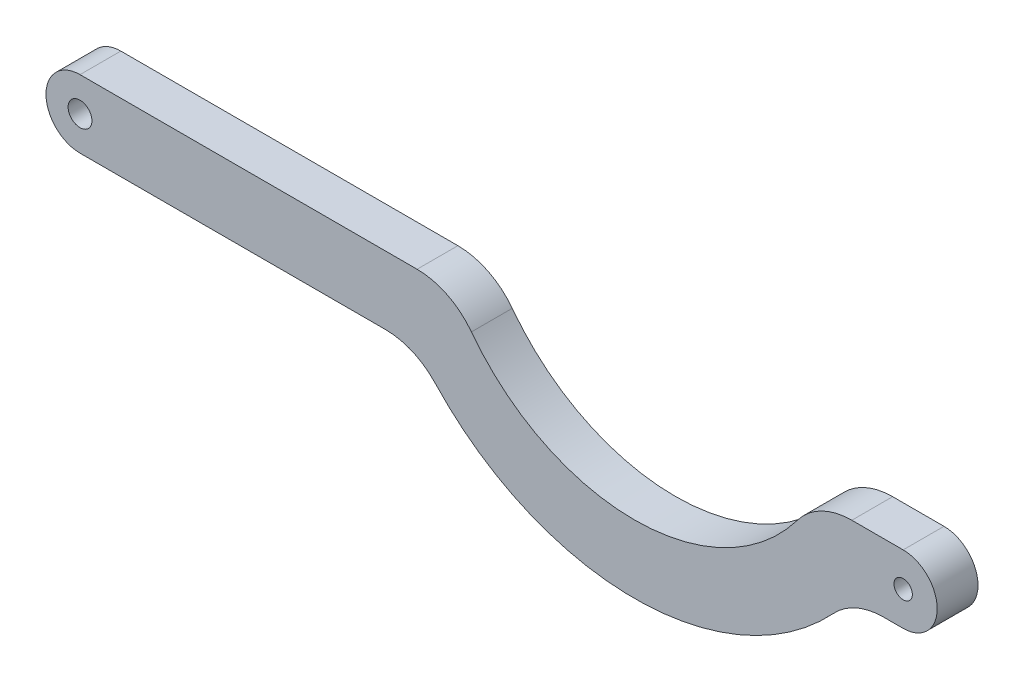
from build123d import *

# Parameters (mm, degrees)
ESQUISSE1_R        = 1.75
ESQUISSE1_R_2      = 1.35
BOSS_EXTRU_1_DEPTH = 6
CHANFREIN1_SIZE    = 1.25
CONG_1_R           = 10


with BuildPart() as part:
    # Esquisse1 → Boss.-Extru.1 (new body)
    with BuildSketch(Plane.XY):
        with BuildLine():
            Line((113.453134084, 0), (121, 0))
            ThreePointArc((121, 0), (126, 5), (121, 10))
            Line((121, 10), (108, 10))
            ThreePointArc((108, 10), (81.5, -5.93763889), (55, 10))
            Line((55, 10), (0, 10))
            ThreePointArc((0, 10), (-5, 5), (0, 0))
            Line((0, 0), (49.546865916, 0))
            ThreePointArc((49.546865916, 0), (81.5, -15.93763889), (113.453134084, 0))
        make_face()
        with Locations((0, 5)):
            Circle(ESQUISSE1_R, mode=Mode.SUBTRACT)
        with Locations((121, 5)):
            Circle(ESQUISSE1_R_2, mode=Mode.SUBTRACT)
    extrude(amount=BOSS_EXTRU_1_DEPTH)

    # Chanfrein1
    chanfrein1_edges = [part.edges().sort_by_distance(p)[0] for p in [
        (-1.75, 5, 0),
    ]]
    chamfer(chanfrein1_edges, length=CHANFREIN1_SIZE)

    # Congé1
    cong_1_edges = [part.edges().sort_by_distance(p)[0] for p in [
        (55, 10, 3),
        (108, 10, 3),
        (113.453134084, 0, 3),
        (49.546865916, 0, 3),
    ]]
    fillet(cong_1_edges, radius=CONG_1_R)


solid = part.part
